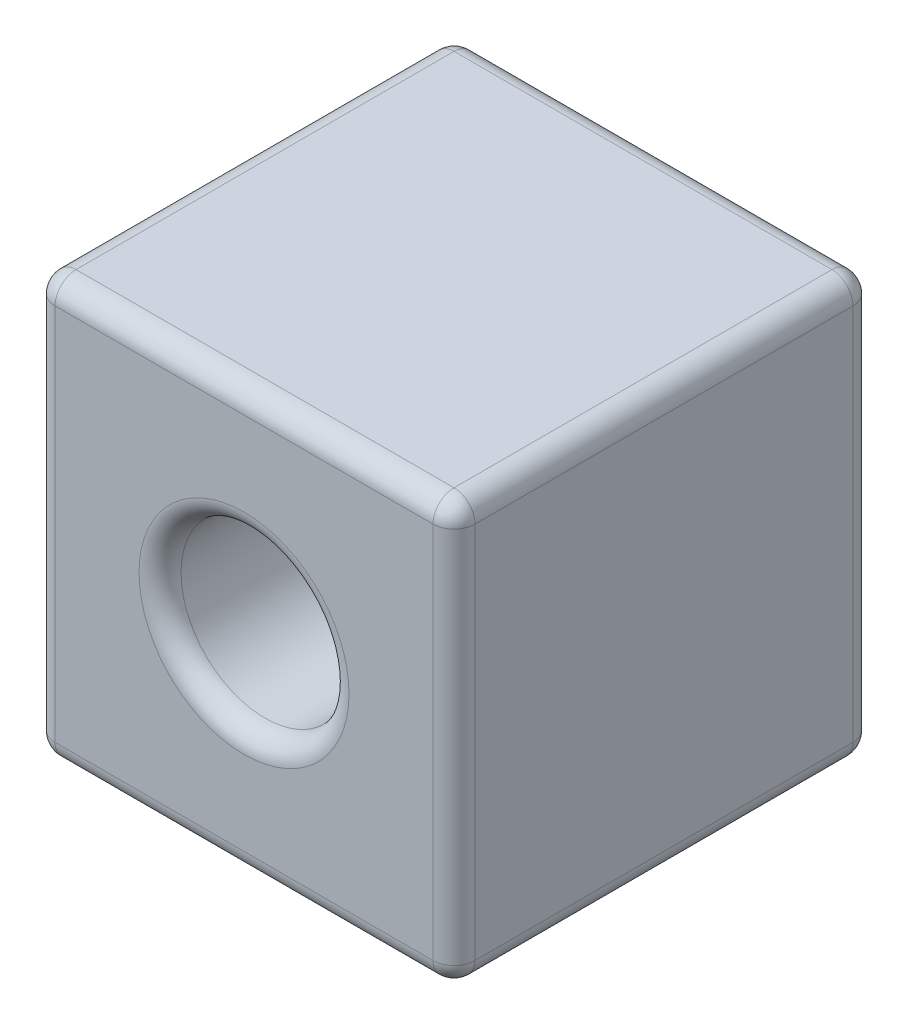
from build123d import *

# Parameters (mm, degrees)
SKETCH_1_W      = 100
SKETCH_1_H      = 100
SKETCH_1_R      = 20
EXTRUDE_1_DEPTH = 100
FILLET_1_R      = 5
FILLET_2_R      = 5


with BuildPart() as part:
    # 草图1 → 凸台-拉伸1 (new body)
    with BuildSketch(Plane.XY):
        Rectangle(SKETCH_1_W, SKETCH_1_H)
        Circle(SKETCH_1_R, mode=Mode.SUBTRACT)
    extrude(amount=EXTRUDE_1_DEPTH)

    # 圆角1
    fillet_1_edges = [part.edges().sort_by_distance(p)[0] for p in [
        (-50, 0, 100),
        (0, -50, 100),
        (50, 0, 100),
        (0, -50, 0),
        (-50, 0, 0),
        (0, 50, 0),
        (50, 0, 0),
        (50, -50, 50),
        (-50, -50, 50),
        (-50, 50, 50),
        (50, 50, 50),
        (0, 50, 100),
    ]]
    fillet(fillet_1_edges, radius=FILLET_1_R)

    # 圆角2
    fillet_2_edges = [part.edges().sort_by_distance(p)[0] for p in [
        (-20, 0, 0),
        (-20, 0, 100),
    ]]
    fillet(fillet_2_edges, radius=FILLET_2_R)


solid = part.part
